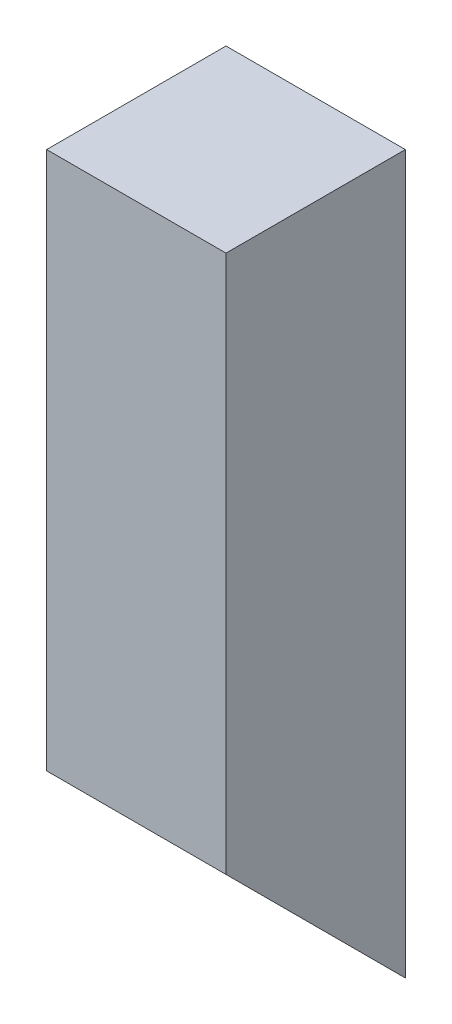
from build123d import *

# Parameters (mm, degrees)
SKETCH1_W           = 88.9
SKETCH1_H           = 88.9
BOSS_EXTRUDE1_DEPTH = 355.6
CUT_EXTRUDE1_DEPTH  = 406.4


with BuildPart() as part:
    # Sketch1 → Boss-Extrude1 (new body)
    with BuildSketch(Plane(origin=(0, 0, 0), x_dir=(1, 0, 0), z_dir=(0, 1, 0))):
        with Locations((44.45, 44.45)):
            Rectangle(SKETCH1_W, SKETCH1_H)
    extrude(amount=BOSS_EXTRUDE1_DEPTH)

    # Sketch3 → Cut-Extrude1 (cut)
    with BuildSketch(Plane(origin=(88.9, 0, 0), x_dir=(0, 0, -1), z_dir=(1, 0, 0))):
        Polygon((0, 0), (88.9, 0), (0, 88.9), align=None)
    extrude(amount=-CUT_EXTRUDE1_DEPTH, mode=Mode.SUBTRACT)


solid = part.part
